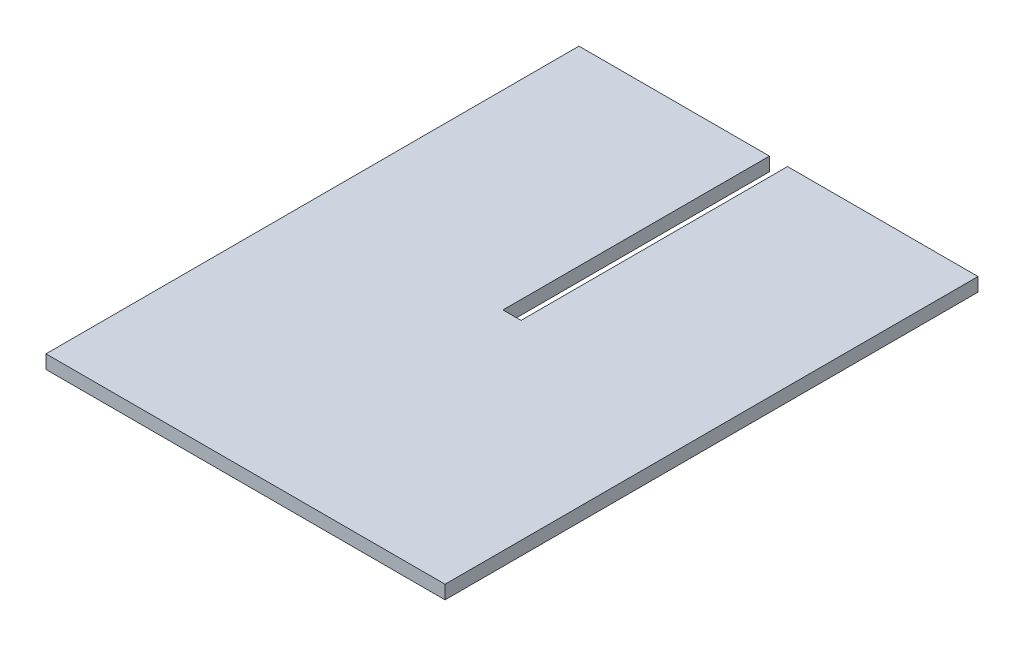
from build123d import *

# Parameters (mm, degrees)
SKETCH1_W           = 44.1
SKETCH1_H           = 58.9
BOSS_EXTRUDE1_DEPTH = 1.5
CUT_EXTRUDE1_REACH  = 38.821
SKETCH2_W           = 2
SKETCH2_H           = 29.45


with BuildPart() as part:
    # Sketch1 → Boss-Extrude1 (new body)
    with BuildSketch(Plane(origin=(0, 0, 0), x_dir=(1, 0, 0), z_dir=(0, 1, 0))):
        Rectangle(SKETCH1_W, SKETCH1_H)
    extrude(amount=BOSS_EXTRUDE1_DEPTH)

    # Sketch2 → Cut-Extrude1 (cut, up to next)
    with BuildSketch(Plane(origin=(0, 1.5, 0), x_dir=(1, 0, 0), z_dir=(0, 1, 0)), mode=Mode.PRIVATE) as cut_extrude1_sk1:
        with Locations((0, 14.725)):
            Rectangle(SKETCH2_W, SKETCH2_H)
    cut_extrude1_tool1 = extrude(cut_extrude1_sk1.sketch, amount=-CUT_EXTRUDE1_REACH, mode=Mode.PRIVATE) & part.part
    add(cut_extrude1_tool1.solids().sort_by_distance((0, 1.5, -14.725))[0], mode=Mode.SUBTRACT)


solid = part.part
